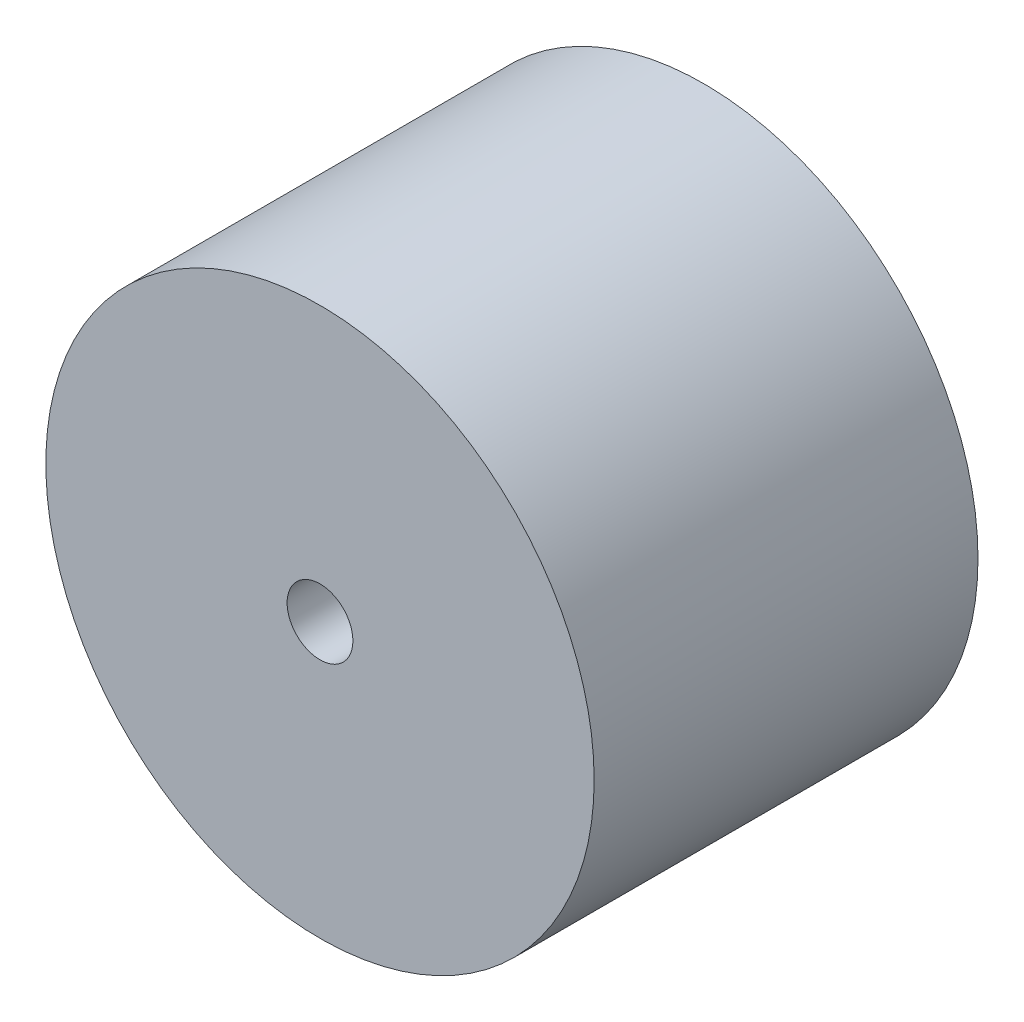
from build123d import *

# Parameters (mm, degrees)
ESQUISSE1_R        = 25
ESQUISSE1_R_2      = 3
BOSS_EXTRU_1_DEPTH = 17.5


with BuildPart() as part:
    # Esquisse1 → Boss.-Extru.1 (new, symmetric)
    with BuildSketch(Plane.XY):
        Circle(ESQUISSE1_R)
        Circle(ESQUISSE1_R_2, mode=Mode.SUBTRACT)
    extrude(amount=BOSS_EXTRU_1_DEPTH, both=True)


solid = part.part
